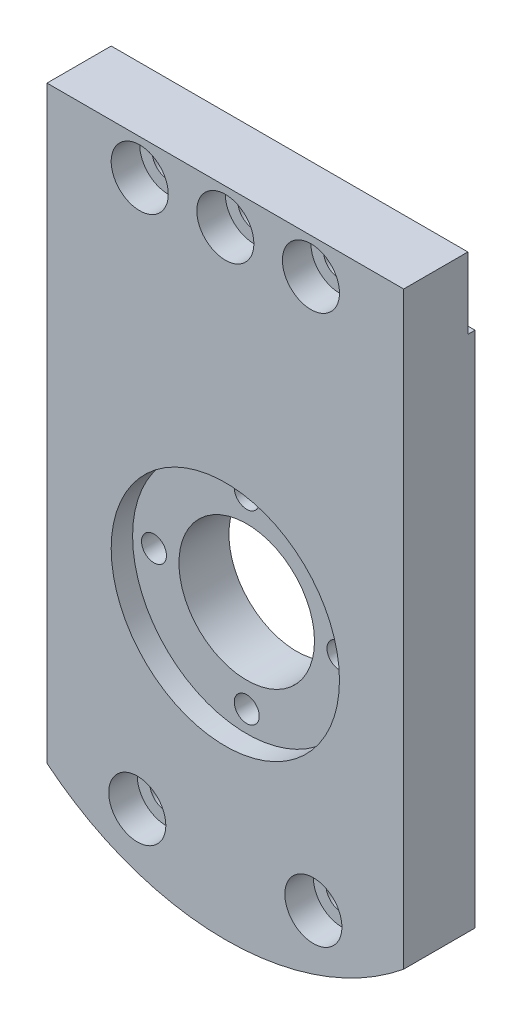
from build123d import *

# Parameters (mm, degrees)
SKETCH_1_R          = 2.25
SKETCH_1_R_2        = 9.5
SKETCH_1_R_3        = 1.75
EXTRUDE_1_DEPTH     = 10
SKETCH_3_R          = 16
CUT_EXTRUDE_1_DEPTH = 3
SKETCH_4_R          = 4
CUT_EXTRUDE_2_DEPTH = 4
SKETCH_5_W          = 50
SKETCH_5_H          = 10
CUT_EXTRUDE_3_DEPTH = 1
SKETCH_6_R          = 3.25
CUT_EXTRUDE_4_DEPTH = 2


with BuildPart() as part:
    # 스케치1 → 보스-돌출1 (new body)
    with BuildSketch(Plane.XY):
        with BuildLine():
            Line((-25, 0), (-25, 52))
            Line((-25, 52), (25, 52))
            Line((25, 52), (25, -30.581857367))
            ThreePointArc((25, -30.581857367), (0, -39.5), (-25, -30.581857367))
            Line((-25, -30.581857367), (-25, 0))
        make_face()
        with Locations((-12.341540694, -29.795114923)):
            Circle(SKETCH_1_R, mode=Mode.SUBTRACT)
        with Locations((12.341540694, -29.795114923)):
            Circle(SKETCH_1_R, mode=Mode.SUBTRACT)
        with Locations((0, 47)):
            Circle(SKETCH_1_R, mode=Mode.SUBTRACT)
        with Locations((12, 47)):
            Circle(SKETCH_1_R, mode=Mode.SUBTRACT)
        with Locations((-12, 47)):
            Circle(SKETCH_1_R, mode=Mode.SUBTRACT)
        Circle(SKETCH_1_R_2, mode=Mode.SUBTRACT)
        with Locations((-13, 0)):
            Circle(SKETCH_1_R_3, mode=Mode.SUBTRACT)
        with Locations((0, 13)):
            Circle(SKETCH_1_R_3, mode=Mode.SUBTRACT)
        with Locations((13, 0)):
            Circle(SKETCH_1_R_3, mode=Mode.SUBTRACT)
        with Locations((0, -13)):
            Circle(SKETCH_1_R_3, mode=Mode.SUBTRACT)
    extrude(amount=EXTRUDE_1_DEPTH)

    # 스케치3 → 컷-돌출1 (cut)
    with BuildSketch(Plane.XY.offset(10)):
        Circle(SKETCH_3_R)
    extrude(amount=-CUT_EXTRUDE_1_DEPTH, mode=Mode.SUBTRACT)

    # 스케치4 → 컷-돌출2 (cut)
    with BuildSketch(Plane.XY.offset(10)):
        with Locations((-12, 47)):
            Circle(SKETCH_4_R)
        with Locations((0, 47)):
            Circle(SKETCH_4_R)
        with Locations((12, 47)):
            Circle(SKETCH_4_R)
        with Locations((12.341540694, -29.795114923)):
            Circle(SKETCH_4_R)
        with Locations((-12.341540694, -29.795114923)):
            Circle(SKETCH_4_R)
    extrude(amount=-CUT_EXTRUDE_2_DEPTH, mode=Mode.SUBTRACT)

    # 스케치5 → 컷-돌출3 (cut)
    with BuildSketch(Plane(origin=(0, 0, 0), x_dir=(-1, 0, 0), z_dir=(0, 0, -1))):
        with Locations((0, 47)):
            Rectangle(SKETCH_5_W, SKETCH_5_H)
    extrude(amount=-CUT_EXTRUDE_3_DEPTH, mode=Mode.SUBTRACT)

    # 스케치6 → 컷-돌출4 (cut)
    with BuildSketch(Plane(origin=(0, 0, 0), x_dir=(-1, 0, 0), z_dir=(0, 0, -1))):
        with Locations((0, 13)):
            Circle(SKETCH_6_R)
        with Locations((13, 0)):
            Circle(SKETCH_6_R)
        with Locations((0, -13)):
            Circle(SKETCH_6_R)
        with Locations((-13, 0)):
            Circle(SKETCH_6_R)
    extrude(amount=-CUT_EXTRUDE_4_DEPTH, mode=Mode.SUBTRACT)


solid = part.part
